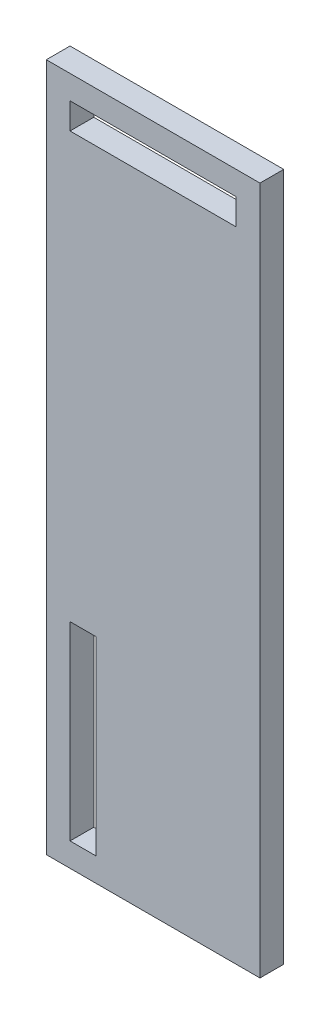
from build123d import *

# Parameters (mm, degrees)
SKETCH2_W           = 57.15
SKETCH2_H           = 184.15
BOSS_EXTRUDE1_DEPTH = 6.35
SKETCH3_W           = 44.45
SKETCH3_H           = 6.985
CUT_EXTRUDE1_DEPTH  = 97.616037747
SKETCH4_W           = 6.985
SKETCH4_H           = 50.8
CUT_EXTRUDE2_DEPTH  = 97.616037747


with BuildPart() as part:
    # Sketch2 → Boss-Extrude1 (new body)
    with BuildSketch(Plane.XY):
        Rectangle(SKETCH2_W, SKETCH2_H)
    extrude(amount=BOSS_EXTRUDE1_DEPTH)

    # Sketch3 → Cut-Extrude1 (cut, through all)
    with BuildSketch(Plane.XY.offset(6.35)):
        with Locations((0, 82.2325)):
            Rectangle(SKETCH3_W, SKETCH3_H)
    extrude(amount=-CUT_EXTRUDE1_DEPTH, mode=Mode.SUBTRACT)

    # Sketch4 → Cut-Extrude2 (cut, through all)
    with BuildSketch(Plane.XY.offset(6.35)):
        with Locations((-18.7325, -60.325)):
            Rectangle(SKETCH4_W, SKETCH4_H)
    extrude(amount=-CUT_EXTRUDE2_DEPTH, mode=Mode.SUBTRACT)


solid = part.part
